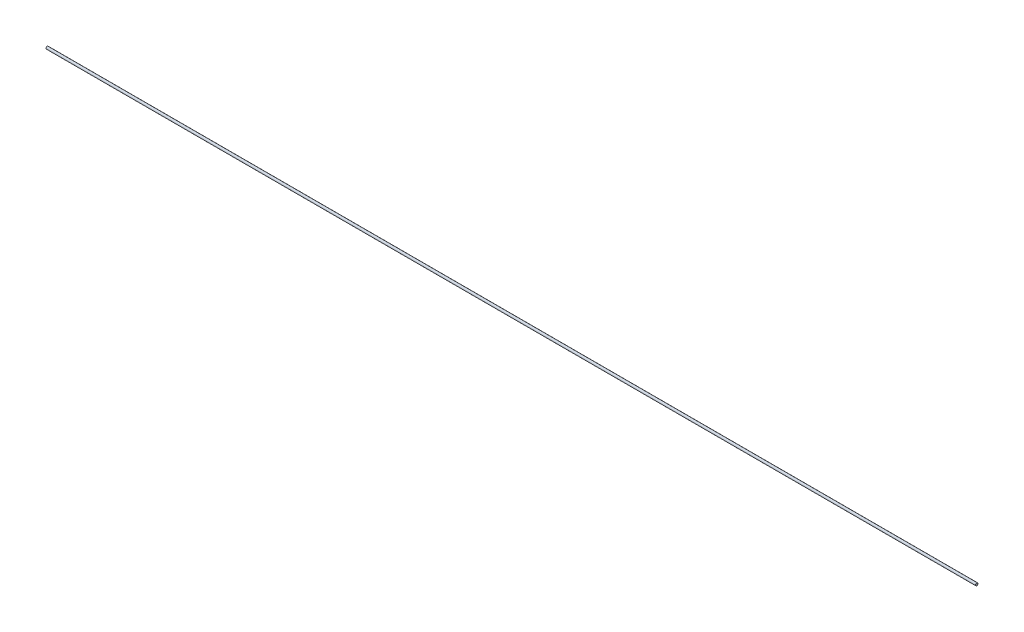
from build123d import *

# Parameters (mm, degrees)
SKETCH_1_R      = 2.5
EXTRUDE_1_DEPTH = 1900


with BuildPart() as part:
    # Эскиз1 → Бобышка-Вытянуть1 (new body)
    with BuildSketch(Plane(origin=(0, 0, 0), x_dir=(0, 0, -1), z_dir=(1, 0, 0))):
        with Locations(Location((0, 0, 0), (0, 0, 180))):
            Circle(SKETCH_1_R)
    extrude(amount=EXTRUDE_1_DEPTH)


solid = part.part
